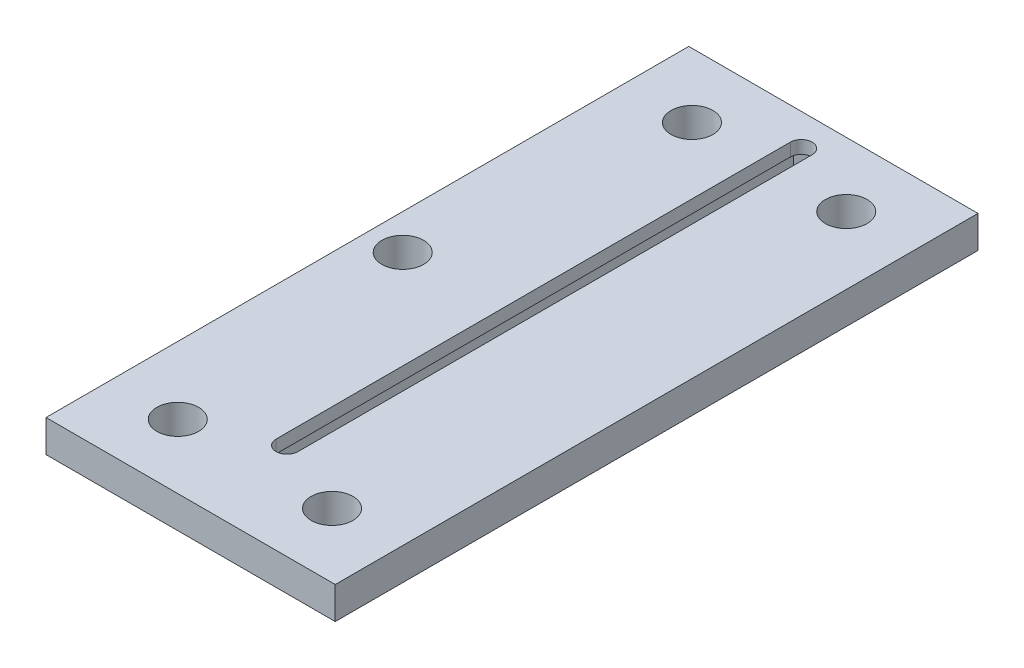
from build123d import *

# Parameters (mm, degrees)
SKETCH1_W           = 45
SKETCH1_H           = 100
SKETCH1_R           = 3.25
BOSS_EXTRUDE1_DEPTH = 5
CUT_EXTRUDE1_DEPTH  = 2
CUT_EXTRUDE2_REACH  = 56.911


with BuildPart() as part:
    # Sketch1 → Boss-Extrude1 (new body)
    with BuildSketch(Plane(origin=(0, 0, 0), x_dir=(1, 0, 0), z_dir=(0, 1, 0))):
        Rectangle(SKETCH1_W, SKETCH1_H)
        with Locations(Location((-12, 40, 0), (0, 0, 270))):
            Circle(SKETCH1_R, mode=Mode.SUBTRACT)
        with Locations(Location((12, 40, 0), (0, 0, 270))):
            Circle(SKETCH1_R, mode=Mode.SUBTRACT)
        with Locations(Location((12, -40, 0), (0, 0, 270))):
            Circle(SKETCH1_R, mode=Mode.SUBTRACT)
        with Locations(Location((-12, -40, 0), (0, 0, 270))):
            Circle(SKETCH1_R, mode=Mode.SUBTRACT)
        with Locations(Location((-17, 0, 0), (0, 0, 270))):
            Circle(SKETCH1_R, mode=Mode.SUBTRACT)
    extrude(amount=BOSS_EXTRUDE1_DEPTH)

    # Sketch2 → Cut-Extrude1 (cut)
    with BuildSketch(Plane(origin=(0, 5, 0), x_dir=(1, 0, 0), z_dir=(0, 1, 0))):
        with BuildLine():
            Line((1.7, 45), (1.7, -35))
            ThreePointArc((1.7, -35), (0, -36.7), (-1.7, -35))
            Line((-1.7, -35), (-1.7, 45))
            ThreePointArc((-1.7, 45), (0, 46.7), (1.7, 45))
        make_face()
    extrude(amount=-CUT_EXTRUDE1_DEPTH, mode=Mode.SUBTRACT)

    # Sketch3 → Cut-Extrude2 (cut, up to next)
    with BuildSketch(Plane(origin=(0, 3, 0), x_dir=(1, 0, 0), z_dir=(0, 1, 0)), mode=Mode.PRIVATE) as cut_extrude2_sk1:
        with BuildLine():
            Line((0, 41.651368439), (1.7, 42.632863896))
            Line((1.7, 42.632863896), (1.7, 45))
            ThreePointArc((1.7, 45), (0, 46.7), (-1.7, 45))
            Line((-1.7, 45), (-1.7, 42.632863896))
            Line((-1.7, 42.632863896), (0, 41.651368439))
        make_face()
    cut_extrude2_tool1 = extrude(cut_extrude2_sk1.sketch, amount=-CUT_EXTRUDE2_REACH, mode=Mode.PRIVATE) & part.part
    # Sketch3 → Cut-Extrude2 (cut, up to next)
    with BuildSketch(Plane(origin=(0, 3, 0), x_dir=(1, 0, 0), z_dir=(0, 1, 0)), mode=Mode.PRIVATE) as cut_extrude2_sk2:
        Polygon((1.7, -32.632863896), (1.7, 42.632863896), (0, 41.651368439), (-1.7, 42.632863896), (-1.7, -32.632863896), (0, -31.651368439), align=None)
    cut_extrude2_tool2 = extrude(cut_extrude2_sk2.sketch, amount=-CUT_EXTRUDE2_REACH, mode=Mode.PRIVATE) & part.part
    # Sketch3 → Cut-Extrude2 (cut, up to next)
    with BuildSketch(Plane(origin=(0, 3, 0), x_dir=(1, 0, 0), z_dir=(0, 1, 0)), mode=Mode.PRIVATE) as cut_extrude2_sk3:
        with BuildLine():
            Line((1.7, -35), (1.7, -32.632863896))
            Line((1.7, -32.632863896), (0, -31.651368439))
            Line((0, -31.651368439), (-1.7, -32.632863896))
            Line((-1.7, -32.632863896), (-1.7, -35))
            ThreePointArc((-1.7, -35), (0, -36.7), (1.7, -35))
        make_face()
    cut_extrude2_tool3 = extrude(cut_extrude2_sk3.sketch, amount=-CUT_EXTRUDE2_REACH, mode=Mode.PRIVATE) & part.part
    # Sketch3 → Cut-Extrude2 (cut, up to next)
    with BuildSketch(Plane(origin=(0, 3, 0), x_dir=(1, 0, 0), z_dir=(0, 1, 0)), mode=Mode.PRIVATE) as cut_extrude2_sk4:
        Polygon((-1.7, -32.632863896), (-1.7, 42.632863896), (-2.9, 43.325684219), (-2.9, -33.325684219), align=None)
    cut_extrude2_tool4 = extrude(cut_extrude2_sk4.sketch, amount=-CUT_EXTRUDE2_REACH, mode=Mode.PRIVATE) & part.part
    # Sketch3 → Cut-Extrude2 (cut, up to next)
    with BuildSketch(Plane(origin=(0, 3, 0), x_dir=(1, 0, 0), z_dir=(0, 1, 0)), mode=Mode.PRIVATE) as cut_extrude2_sk5:
        Polygon((2.9, -33.325684219), (2.9, 43.325684219), (1.7, 42.632863896), (1.7, -32.632863896), align=None)
    cut_extrude2_tool5 = extrude(cut_extrude2_sk5.sketch, amount=-CUT_EXTRUDE2_REACH, mode=Mode.PRIVATE) & part.part
    # Sketch3 → Cut-Extrude2 (cut, up to next)
    with BuildSketch(Plane(origin=(0, 3, 0), x_dir=(1, 0, 0), z_dir=(0, 1, 0)), mode=Mode.PRIVATE) as cut_extrude2_sk6:
        with BuildLine():
            Line((1.7, 42.632863896), (2.9, 43.325684219))
            Line((2.9, 43.325684219), (2.9, 46.674315781))
            Line((2.9, 46.674315781), (0, 48.348631561))
            Line((0, 48.348631561), (-2.9, 46.674315781))
            Line((-2.9, 46.674315781), (-2.9, 43.325684219))
            Line((-2.9, 43.325684219), (-1.7, 42.632863896))
            Line((-1.7, 42.632863896), (-1.7, 45))
            ThreePointArc((-1.7, 45), (0, 46.7), (1.7, 45))
            Line((1.7, 45), (1.7, 42.632863896))
        make_face()
    cut_extrude2_tool6 = extrude(cut_extrude2_sk6.sketch, amount=-CUT_EXTRUDE2_REACH, mode=Mode.PRIVATE) & part.part
    # Sketch3 → Cut-Extrude2 (cut, up to next)
    with BuildSketch(Plane(origin=(0, 3, 0), x_dir=(1, 0, 0), z_dir=(0, 1, 0)), mode=Mode.PRIVATE) as cut_extrude2_sk7:
        with BuildLine():
            Line((2.9, -36.674315781), (2.9, -33.325684219))
            Line((2.9, -33.325684219), (1.7, -32.632863896))
            Line((1.7, -32.632863896), (1.7, -35))
            ThreePointArc((1.7, -35), (0, -36.7), (-1.7, -35))
            Line((-1.7, -35), (-1.7, -32.632863896))
            Line((-1.7, -32.632863896), (-2.9, -33.325684219))
            Line((-2.9, -33.325684219), (-2.9, -36.674315781))
            Line((-2.9, -36.674315781), (0, -38.348631561))
            Line((0, -38.348631561), (2.9, -36.674315781))
        make_face()
    cut_extrude2_tool7 = extrude(cut_extrude2_sk7.sketch, amount=-CUT_EXTRUDE2_REACH, mode=Mode.PRIVATE) & part.part
    add(cut_extrude2_tool1.solids().sort_by_distance((0, 3, -44.246241))[0], mode=Mode.SUBTRACT)
    add(cut_extrude2_tool2.solids().sort_by_distance((0, 3, -5))[0], mode=Mode.SUBTRACT)
    add(cut_extrude2_tool3.solids().sort_by_distance((0, 3, 34.246241))[0], mode=Mode.SUBTRACT)
    add(cut_extrude2_tool4.solids().sort_by_distance((-2.301824, 3, -5))[0], mode=Mode.SUBTRACT)
    add(cut_extrude2_tool5.solids().sort_by_distance((2.301824, 3, -5))[0], mode=Mode.SUBTRACT)
    add(cut_extrude2_tool6.solids().sort_by_distance((2.259285, 3, -43.049795))[0], mode=Mode.SUBTRACT)
    add(cut_extrude2_tool7.solids().sort_by_distance((1.409285, 3, 37.440952))[0], mode=Mode.SUBTRACT)


solid = part.part
